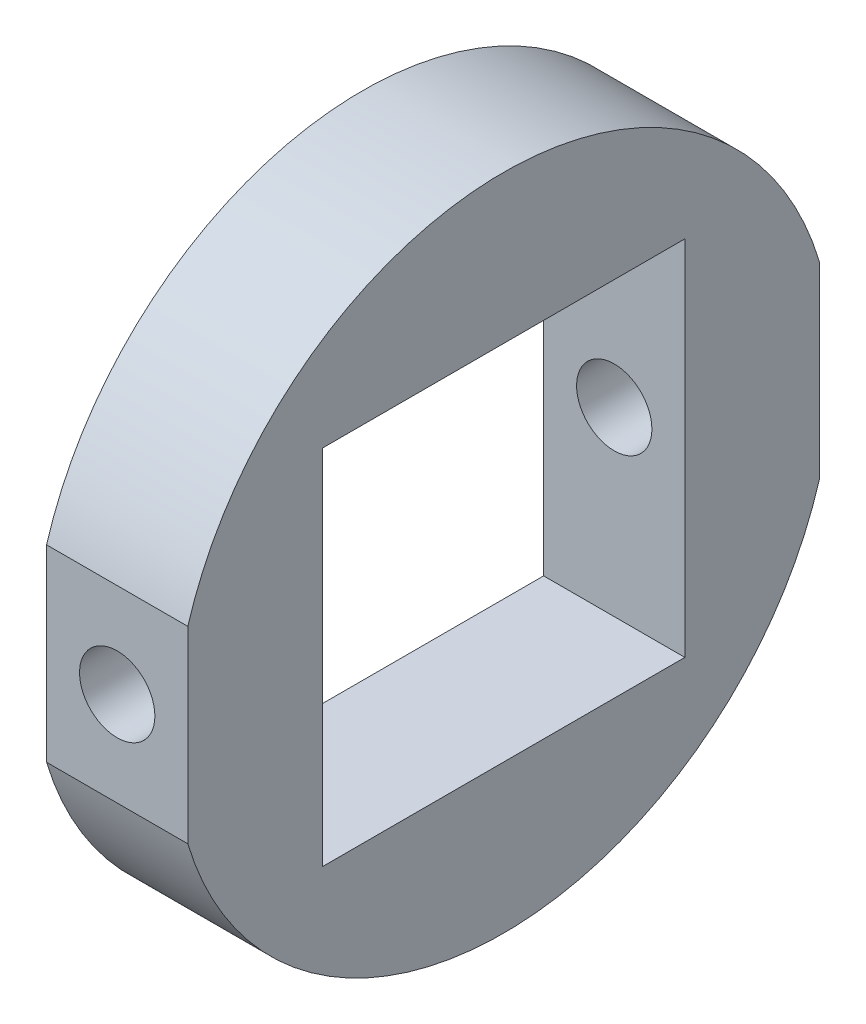
from build123d import *

# Parameters (mm, degrees)
SKETCH_1_W          = 15.4
SKETCH_1_H          = 15.4
EXTRUDE_1_DEPTH     = 3
SKETCH_3_R          = 1.6
CUT_EXTRUDE_1_DEPTH = 31.413812651


with BuildPart() as part:
    # 草图1 → 凸台-拉伸1 (new, symmetric)
    with BuildSketch(Plane(origin=(0, 0, 0), x_dir=(0, 0, -1), z_dir=(1, 0, 0))):
        with BuildLine():
            Line((13.416407865, 4), (13.416407865, -4))
            ThreePointArc((13.416407865, -4), (0, -14), (-13.416407865, -4))
            Line((-13.416407865, -4), (-13.416407865, 4))
            ThreePointArc((-13.416407865, 4), (0, 14), (13.416407865, 4))
        make_face()
        Rectangle(SKETCH_1_W, SKETCH_1_H, mode=Mode.SUBTRACT)
    extrude(amount=EXTRUDE_1_DEPTH, both=True)

    # 草图3 → 切除-拉伸1 (cut, through all)
    with BuildSketch(Plane.XY.offset(13.416407865)):
        Circle(SKETCH_3_R)
    extrude(amount=-CUT_EXTRUDE_1_DEPTH, mode=Mode.SUBTRACT)


solid = part.part
